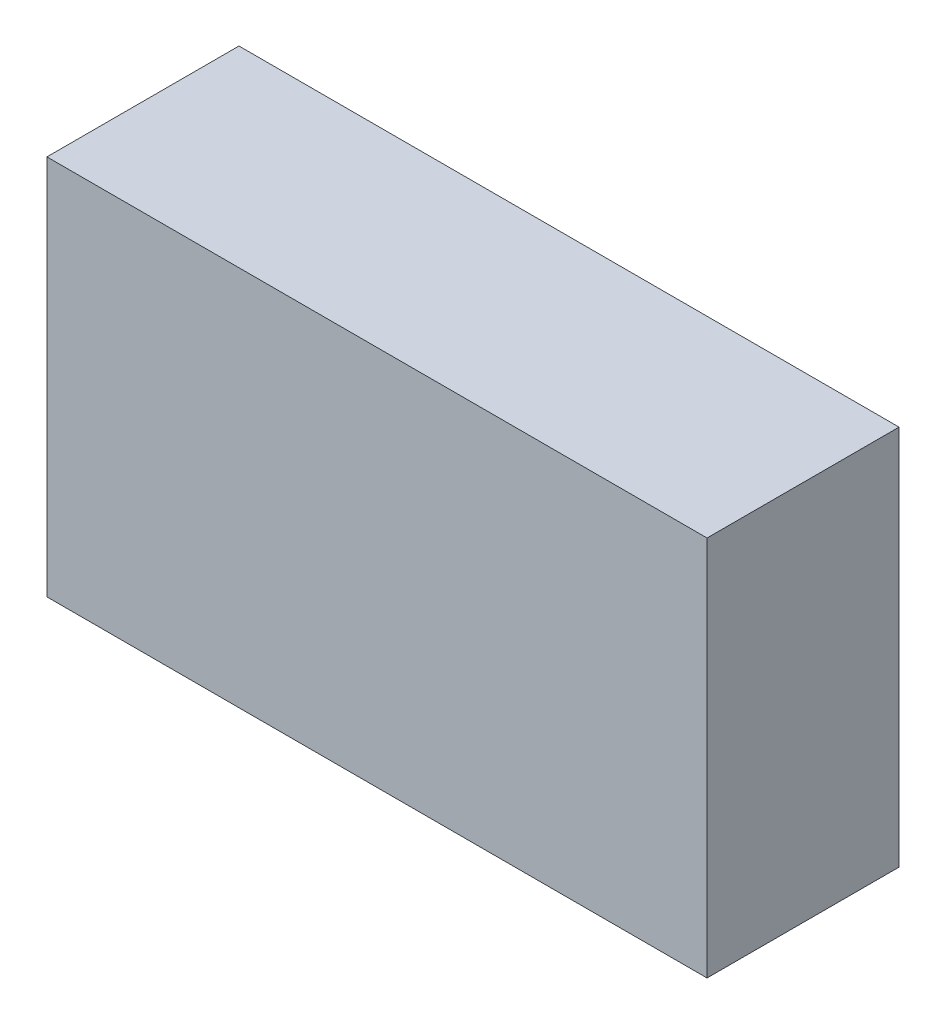
from build123d import *

# Parameters (mm, degrees)
CROQUIS1_W              = 110
CROQUIS1_H              = 63.5
SALIENTE_EXTRUIR1_DEPTH = 32


with BuildPart() as part:
    # Croquis1 → Saliente-Extruir1 (new body)
    with BuildSketch(Plane.XY):
        Rectangle(CROQUIS1_W, CROQUIS1_H)
    extrude(amount=SALIENTE_EXTRUIR1_DEPTH)


solid = part.part
